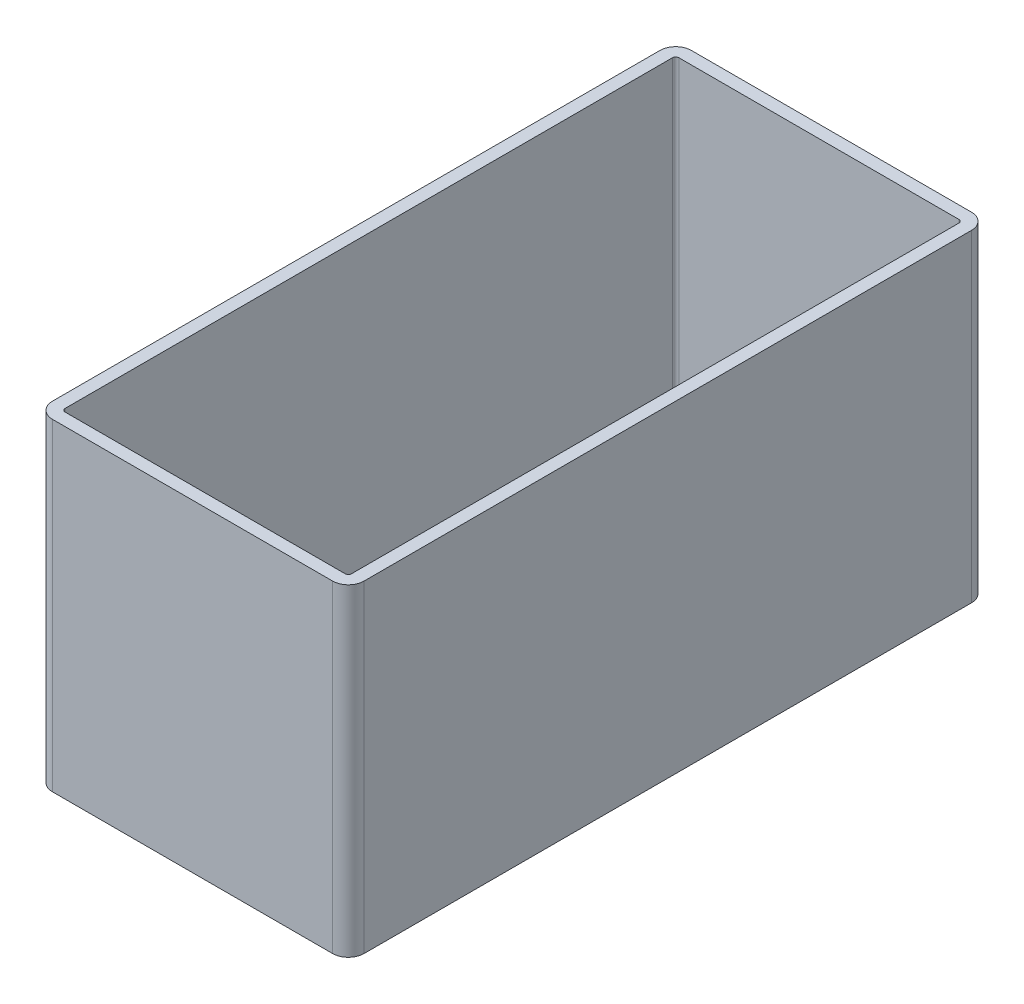
from build123d import *

# Parameters (mm, degrees)
BASES_W            = 19.8
BASES_H            = 40.6
BASE_DEPTH         = 10.25
BASE_F_R           = 1
CUT_EXTRUDE3_DEPTH = 31.5016393


with BuildPart() as part:
    # BaseS → BASE (new, symmetric)
    with BuildSketch(Plane(origin=(0, 0, 0), x_dir=(1, 0, 0), z_dir=(0, 1, 0))):
        Rectangle(BASES_W, BASES_H)
    extrude(amount=BASE_DEPTH, both=True)

    # BASE F
    base_f_edges = [part.edges().sort_by_distance(p)[0] for p in [
        (9.9, 0, 20.3),
        (-9.9, 0, 20.3),
        (-9.9, 0, -20.3),
        (9.9, 0, -20.3),
    ]]
    fillet(base_f_edges, radius=BASE_F_R)

    # PocketS → Cut-Extrude3 (cut, through all)
    with BuildSketch(Plane(origin=(0, 10.25, 0), x_dir=(1, 0, 0), z_dir=(0, 1, 0))):
        with BuildLine():
            Line((8.9, 19.5), (-8.9, 19.5))
            ThreePointArc((-8.9, 19.5), (-9.041421356, 19.441421356), (-9.1, 19.3))
            Line((-9.1, 19.3), (-9.1, -19.3))
            ThreePointArc((-9.1, -19.3), (-9.041421356, -19.441421356), (-8.9, -19.5))
            Line((-8.9, -19.5), (8.9, -19.5))
            ThreePointArc((8.9, -19.5), (9.041421356, -19.441421356), (9.1, -19.3))
            Line((9.1, -19.3), (9.1, 19.3))
            ThreePointArc((9.1, 19.3), (9.041421356, 19.441421356), (8.9, 19.5))
        make_face()
    extrude(amount=-CUT_EXTRUDE3_DEPTH, mode=Mode.SUBTRACT)


solid = part.part
